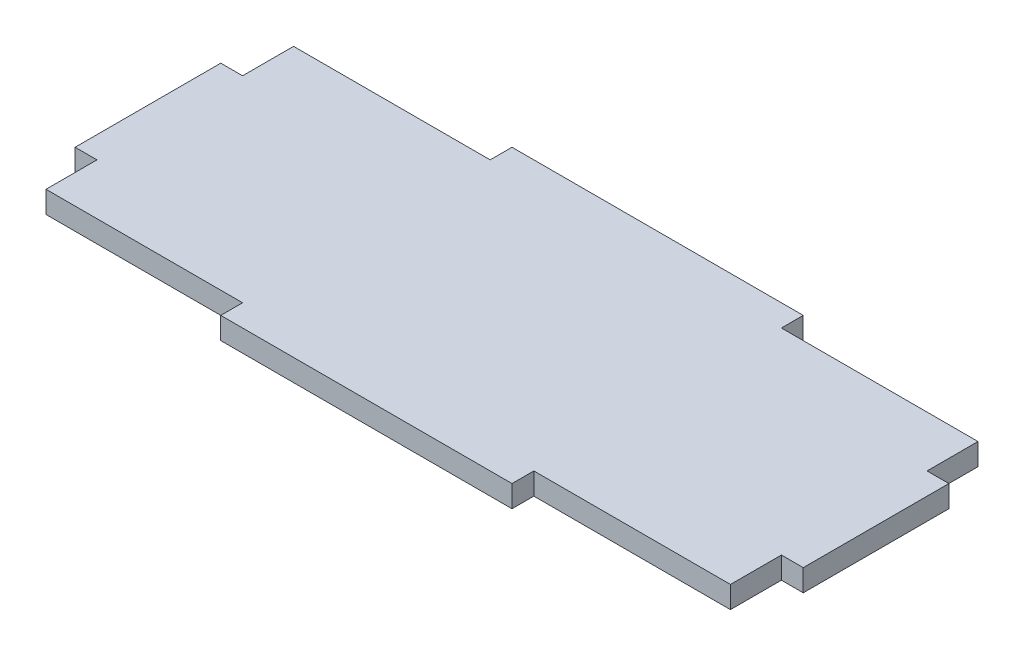
from build123d import *

# Parameters (mm, degrees)
BOSS_EXTRU_1_DEPTH = 3


with BuildPart() as part:
    # Esquisse1 → Boss.-Extru.1 (new body)
    with BuildSketch(Plane(origin=(0, 0, 0), x_dir=(1, 0, 0), z_dir=(0, 1, 0))):
        Polygon((-12.654463931, 12.468102837), (27.345536069, 12.468102837), (27.345536069, 9.468102837), (54.345536069, 9.468102837), (54.345536069, 2.468102837), (57.345536069, 2.468102837), (57.345536069, -17.531897163), (54.345536069, -17.531897163), (54.345536069, -24.531897163), (27.345536069, -24.531897163), (27.345536069, -27.531897163), (-12.654463931, -27.531897163), (-12.654463931, -24.531897163), (-39.654463931, -24.531897163), (-39.654463931, -17.531897163), (-42.654463931, -17.531897163), (-42.654463931, 2.468102837), (-39.654463931, 2.468102837), (-39.654463931, 9.468102837), (-12.654463931, 9.468102837), align=None)
    extrude(amount=BOSS_EXTRU_1_DEPTH)


solid = part.part
